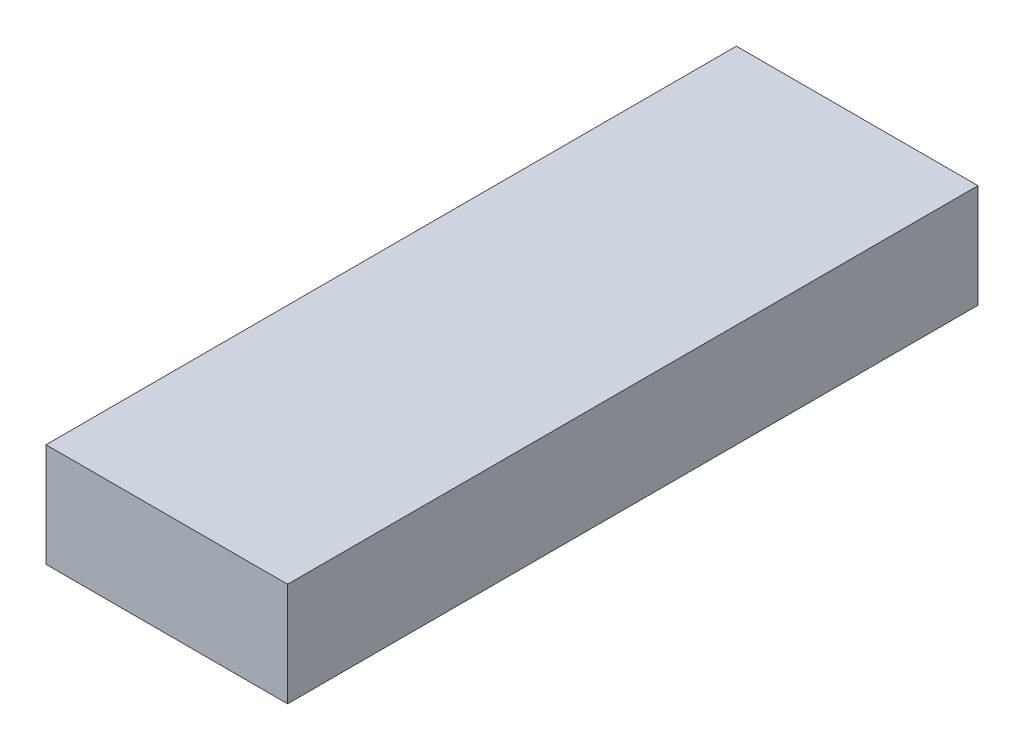
from build123d import *

# Parameters (mm, degrees)
SKETCH1_W           = 700
SKETCH1_H           = 2000
BOSS_EXTRUDE1_DEPTH = 300


with BuildPart() as part:
    # Sketch1 → Boss-Extrude1 (new body)
    with BuildSketch(Plane(origin=(0, 0, 0), x_dir=(1, 0, 0), z_dir=(0, 1, 0))):
        Rectangle(SKETCH1_W, SKETCH1_H)
    extrude(amount=BOSS_EXTRUDE1_DEPTH)


solid = part.part
